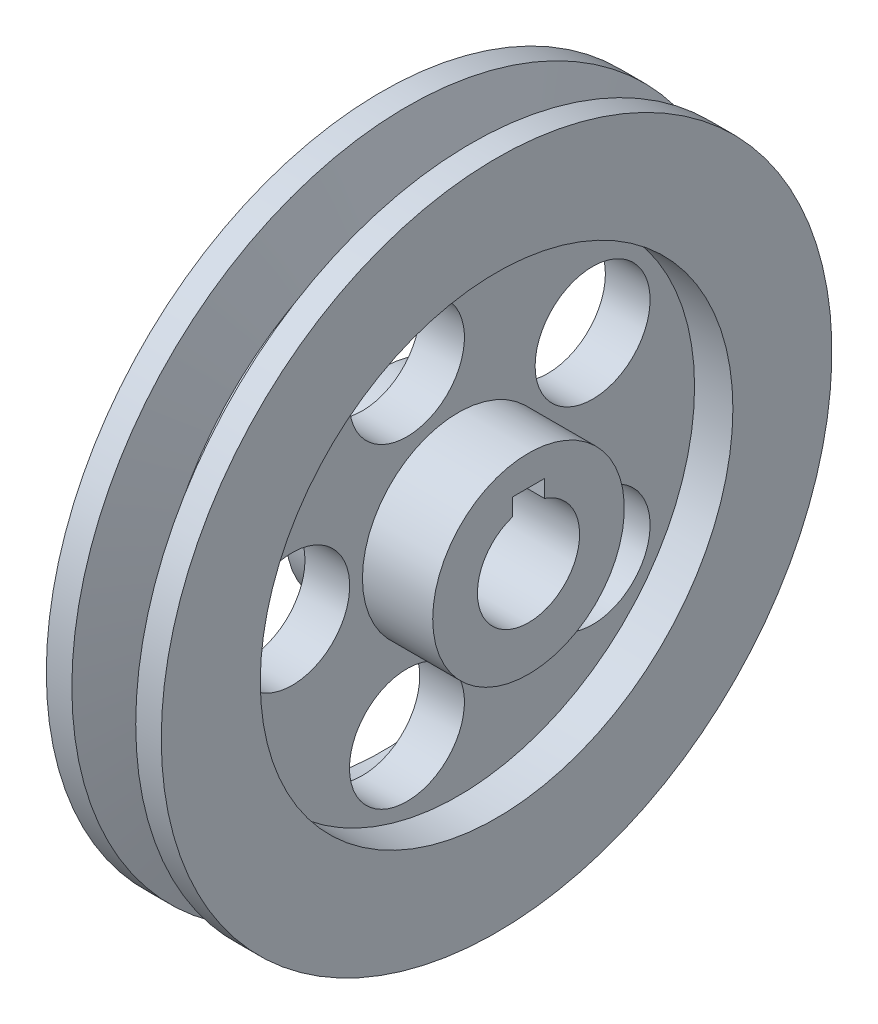
from build123d import *

# Parameters (mm, degrees)
SKETCH_2_R        = 8
F_02_BORE_DEPTH   = 25
SKETCH_3_W        = 5
SKETCH_3_H        = 3.3
F_03_KEYWAY_DEPTH = 25
SKETCH_4_R        = 9
F_04_HOLE_0_DEPTH = 9
SKETCH_5_R        = 9
F_04_HOLE_1_DEPTH = 9
SKETCH_6_R        = 9
F_04_HOLE_2_DEPTH = 9
SKETCH_7_R        = 9
F_04_HOLE_3_DEPTH = 9
SKETCH_8_R        = 9
F_04_HOLE_4_DEPTH = 9


with BuildPart() as part:
    # 草图1 → 01_BODY (revolve)
    with BuildSketch(Plane.XY, mode=Mode.PRIVATE) as f_01_body_sk:
        Polygon((0, 0), (23, 0), (23, 15), (12, 15), (12, 37), (18, 37), (18, 52.5), (14, 52.5), (11.320508076, 42.5), (6.679491924, 42.5), (4, 52.5), (0, 52.5), (0, 37), (5, 37), (5, 15), (0, 15), align=None)
    revolve(f_01_body_sk.sketch.rotate(Axis((-5, 0, 0), (1, 0, 0)), 90), axis=Axis((-5, 0, 0), (1, 0, 0)))

    # 草图2 → 02_BORE (cut)
    with BuildSketch(Plane(origin=(-1, 0, 0), x_dir=(0, 0, -1), z_dir=(1, 0, 0))):
        with Locations(Location((0, 0, 0), (0, 0, 180))):
            Circle(SKETCH_2_R)
    extrude(amount=F_02_BORE_DEPTH, mode=Mode.SUBTRACT)

    # 草图3 → 03_KEYWAY (cut)
    with BuildSketch(Plane(origin=(-1, 0, 0), x_dir=(0, 0, -1), z_dir=(1, 0, 0))):
        with Locations((0, 8.65)):
            Rectangle(SKETCH_3_W, SKETCH_3_H)
    extrude(amount=F_03_KEYWAY_DEPTH, mode=Mode.SUBTRACT)

    # 草图4 → 04_HOLE_0 (cut)
    with BuildSketch(Plane(origin=(4, 0, 0), x_dir=(0, 0, -1), z_dir=(1, 0, 0))):
        with Locations(Location((-26, 0, 0), (0, 0, 180))):
            Circle(SKETCH_4_R)
    extrude(amount=F_04_HOLE_0_DEPTH, mode=Mode.SUBTRACT)

    # 草图5 → 04_HOLE_1 (cut)
    with BuildSketch(Plane(origin=(4, 0, 0), x_dir=(0, 0, -1), z_dir=(1, 0, 0))):
        with Locations(Location((-8.034441854, -24.727469424, 0), (0, 0, 180))):
            Circle(SKETCH_5_R)
    extrude(amount=F_04_HOLE_1_DEPTH, mode=Mode.SUBTRACT)

    # 草图6 → 04_HOLE_2 (cut)
    with BuildSketch(Plane(origin=(4, 0, 0), x_dir=(0, 0, -1), z_dir=(1, 0, 0))):
        with Locations(Location((21.034441854, -15.28241656, 0), (0, 0, 180))):
            Circle(SKETCH_6_R)
    extrude(amount=F_04_HOLE_2_DEPTH, mode=Mode.SUBTRACT)

    # 草图7 → 04_HOLE_3 (cut)
    with BuildSketch(Plane(origin=(4, 0, 0), x_dir=(0, 0, -1), z_dir=(1, 0, 0))):
        with Locations(Location((21.034441854, 15.28241656, 0), (0, 0, 180))):
            Circle(SKETCH_7_R)
    extrude(amount=F_04_HOLE_3_DEPTH, mode=Mode.SUBTRACT)

    # 草图8 → 04_HOLE_4 (cut)
    with BuildSketch(Plane(origin=(4, 0, 0), x_dir=(0, 0, -1), z_dir=(1, 0, 0))):
        with Locations(Location((-8.034441854, 24.727469424, 0), (0, 0, 180))):
            Circle(SKETCH_8_R)
    extrude(amount=F_04_HOLE_4_DEPTH, mode=Mode.SUBTRACT)


solid = part.part
